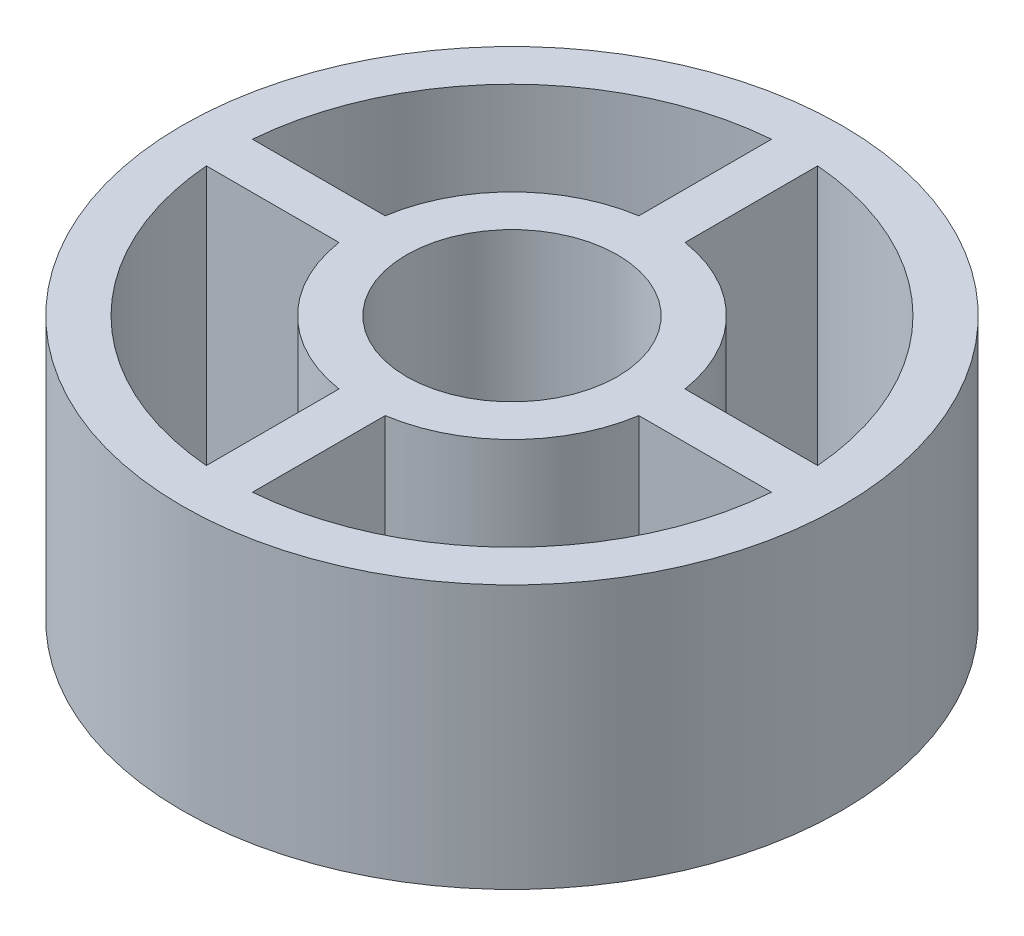
from build123d import *

# Parameters (mm, degrees)
SKETCH_1_R      = 5
SKETCH_1_R_2    = 1.6
EXTRUDE_1_DEPTH = 4


with BuildPart() as part:
    # 草图1 → 凸台-拉伸1 (new body)
    with BuildSketch(Plane(origin=(0, 0, 0), x_dir=(1, 0, 0), z_dir=(0, 1, 0))):
        with Locations(Location((0, 0, 0), (0, 0, 270))):
            Circle(SKETCH_1_R)
        with Locations(Location((0, 0, 0), (0, 0, 270))):
            Circle(SKETCH_1_R_2, mode=Mode.SUBTRACT)
        with BuildLine():
            Line((2.273213584, 0.35), (4.285732143, 0.35))
            ThreePointArc((4.285732143, 0.35), (3.040559159, 3.040559159), (0.35, 4.285732143))
            Line((0.35, 4.285732143), (0.35, 2.273213584))
            ThreePointArc((0.35, 2.273213584), (1.626345597, 1.626345597), (2.273213584, 0.35))
        make_face(mode=Mode.SUBTRACT)
        with BuildLine():
            Line((4.285732143, -0.35), (2.273213584, -0.35))
            ThreePointArc((2.273213584, -0.35), (1.626345597, -1.626345597), (0.35, -2.273213584))
            Line((0.35, -2.273213584), (0.35, -4.285732143))
            ThreePointArc((0.35, -4.285732143), (3.040559159, -3.040559159), (4.285732143, -0.35))
        make_face(mode=Mode.SUBTRACT)
        with BuildLine():
            Line((-0.35, -4.285732143), (-0.35, -2.273213584))
            ThreePointArc((-0.35, -2.273213584), (-1.626345597, -1.626345597), (-2.273213584, -0.35))
            Line((-2.273213584, -0.35), (-4.285732143, -0.35))
            ThreePointArc((-4.285732143, -0.35), (-3.040559159, -3.040559159), (-0.35, -4.285732143))
        make_face(mode=Mode.SUBTRACT)
        with BuildLine():
            Line((-4.285732143, 0.35), (-2.273213584, 0.35))
            ThreePointArc((-2.273213584, 0.35), (-1.626345597, 1.626345597), (-0.35, 2.273213584))
            Line((-0.35, 2.273213584), (-0.35, 4.285732143))
            ThreePointArc((-0.35, 4.285732143), (-3.040559159, 3.040559159), (-4.285732143, 0.35))
        make_face(mode=Mode.SUBTRACT)
    extrude(amount=EXTRUDE_1_DEPTH)


solid = part.part
